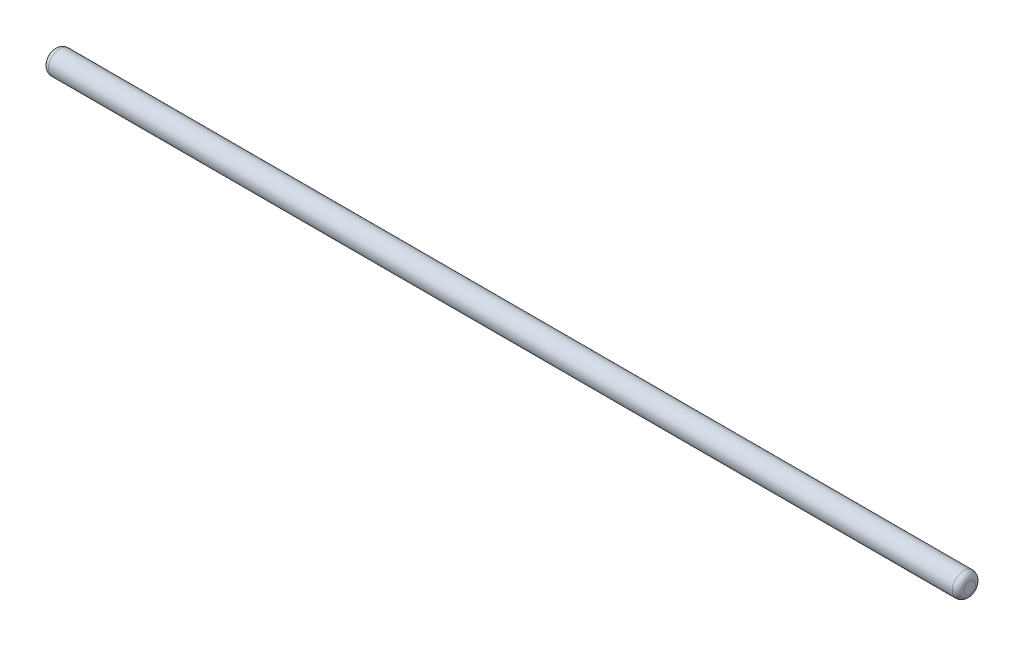
from build123d import *

# Parameters (mm, degrees)
SKETCH1_R           = 2
BOSS_EXTRUDE1_DEPTH = 157
FILLET1_R           = 1


with BuildPart() as part:
    # Sketch1 → Boss-Extrude1 (new body)
    with BuildSketch(Plane(origin=(0, 0, 0), x_dir=(0, 0, -1), z_dir=(1, 0, 0))):
        Circle(SKETCH1_R)
    extrude(amount=BOSS_EXTRUDE1_DEPTH)

    # Fillet1
    fillet1_edges = [part.edges().sort_by_distance(p)[0] for p in [
        (0, 0, 2),
        (157, 0, 2),
    ]]
    fillet(fillet1_edges, radius=FILLET1_R)


solid = part.part
